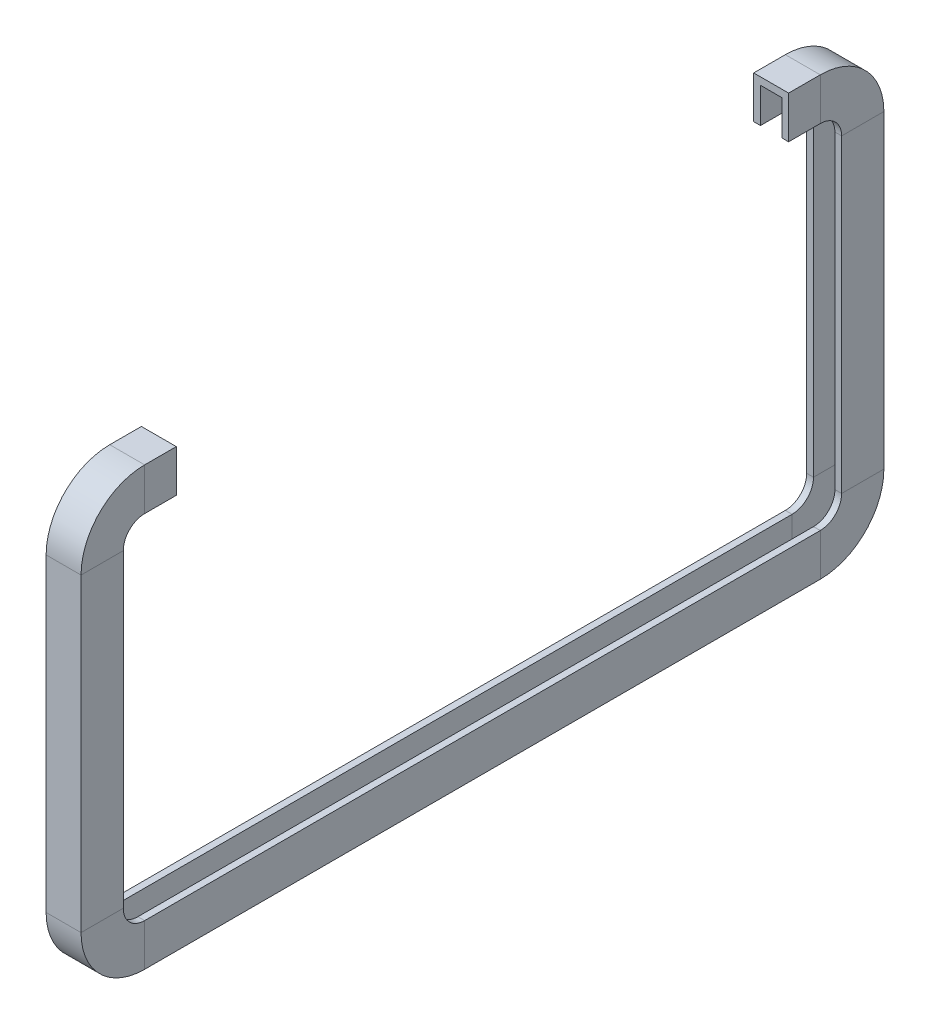
from build123d import *


with BuildPart() as part:
    # Sweep3: sweep along a path in Sketch3
    with BuildLine(Plane(origin=(0, 0, 0), x_dir=(0, 0, -1), z_dir=(1, 0, 0))) as sweep3_path:
        Line((0, 0), (-7.1374, 0))
        ThreePointArc((-7.1374, 0), (-16.117656121, -3.719743879), (-19.8374, -12.7))
        Line((-19.8374, -12.7), (-19.8374, -82.55))
        ThreePointArc((-19.8374, -82.55), (-16.117656121, -91.530256121), (-7.1374, -95.25))
        Line((-7.1374, -95.25), (145.2626, -95.25))
        ThreePointArc((145.2626, -95.25), (154.242856121, -91.530256121), (157.9626, -82.55))
        Line((157.9626, -82.55), (157.9626, -12.7))
        ThreePointArc((157.9626, -12.7), (154.242856121, -3.719743879), (145.2626, 0))
        Line((145.2626, 0), (138.1252, 0))
    # Sketch2 → Sweep3 (sweep)
    with BuildSketch(Plane.XY):
        Polygon((0, 0), (4.826, 0), (4.826, -7.874), (6.35, -7.874), (6.35, 1.651), (-1.524, 1.651), (-1.524, -7.874), (0, -7.874), align=None)
    sweep(path=sweep3_path.line)


solid = part.part
